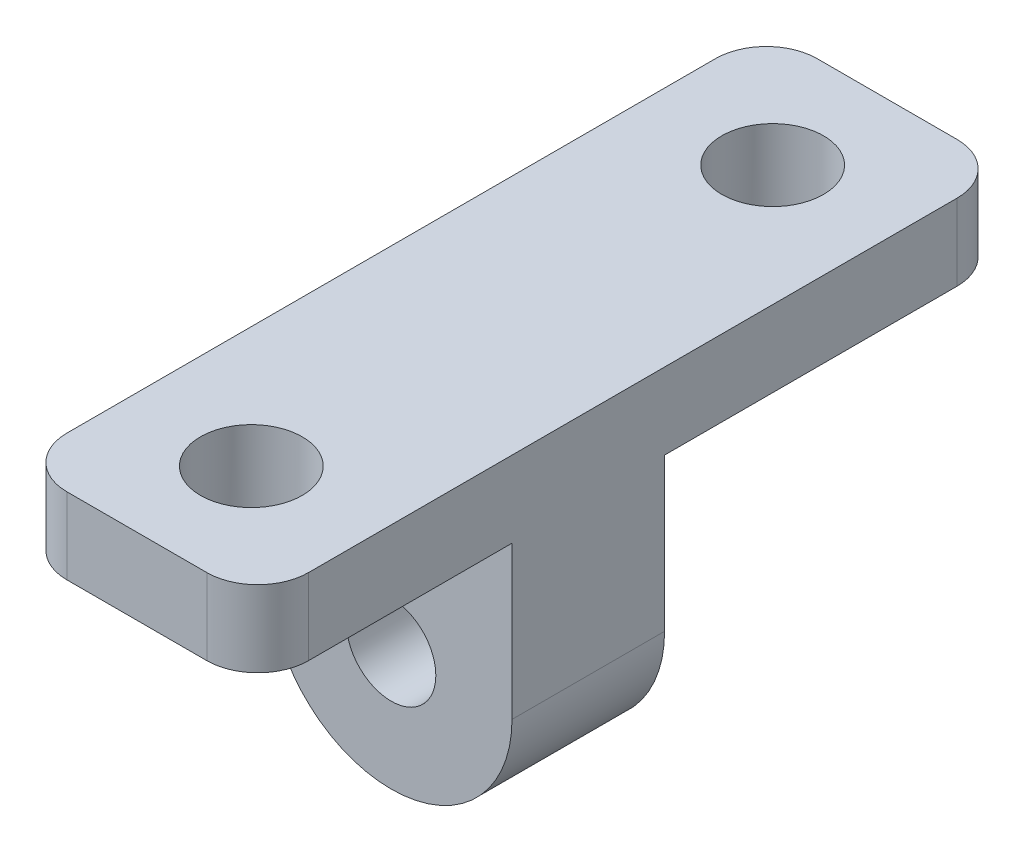
from build123d import *

# Parameters (mm, degrees)
SKETCH2_R           = 1.755
BOSS_EXTRUDE1_DEPTH = 6
SKETCH3_W           = 9.5
SKETCH3_H           = 29.5
BOSS_EXTRUDE2_DEPTH = 3
SKETCH4_R           = 2
CUT_EXTRUDE1_DEPTH  = 22.624638725
FILLET1_R           = 2


with BuildPart() as part:
    # Sketch2 → Boss-Extrude1 (new body)
    with BuildSketch(Plane.XY):
        with BuildLine():
            Line((-4.75, 6), (-4.75, 0))
            ThreePointArc((-4.75, 0), (0, -4.75), (4.75, 0))
            Line((4.75, 0), (4.75, 6))
            Line((4.75, 6), (-4.75, 6))
        make_face()
        Circle(SKETCH2_R, mode=Mode.SUBTRACT)
    extrude(amount=BOSS_EXTRUDE1_DEPTH)

    # Sketch3 → Boss-Extrude2 (add)
    with BuildSketch(Plane(origin=(0, 6, 0), x_dir=(1, 0, 0), z_dir=(0, 1, 0))):
        with Locations((0, -1.25)):
            Rectangle(SKETCH3_W, SKETCH3_H)
    extrude(amount=BOSS_EXTRUDE2_DEPTH)

    # Sketch4 → Cut-Extrude1 (cut, through all)
    with BuildSketch(Plane(origin=(0, 9, 0), x_dir=(1, 0, 0), z_dir=(0, 1, 0))):
        with Locations(Location((0, -11.5, 0), (0, 0, 270))):
            Circle(SKETCH4_R)
        with Locations(Location((0, 9, 0), (0, 0, 270))):
            Circle(SKETCH4_R)
    extrude(amount=-CUT_EXTRUDE1_DEPTH, mode=Mode.SUBTRACT)

    # Fillet1
    fillet1_edges = [part.edges().sort_by_distance(p)[0] for p in [
        (4.75, 7.5, -13.5),
        (-4.75, 7.5, -13.5),
        (-4.75, 7.5, 16),
        (4.75, 7.5, 16),
    ]]
    fillet(fillet1_edges, radius=FILLET1_R)


solid = part.part
